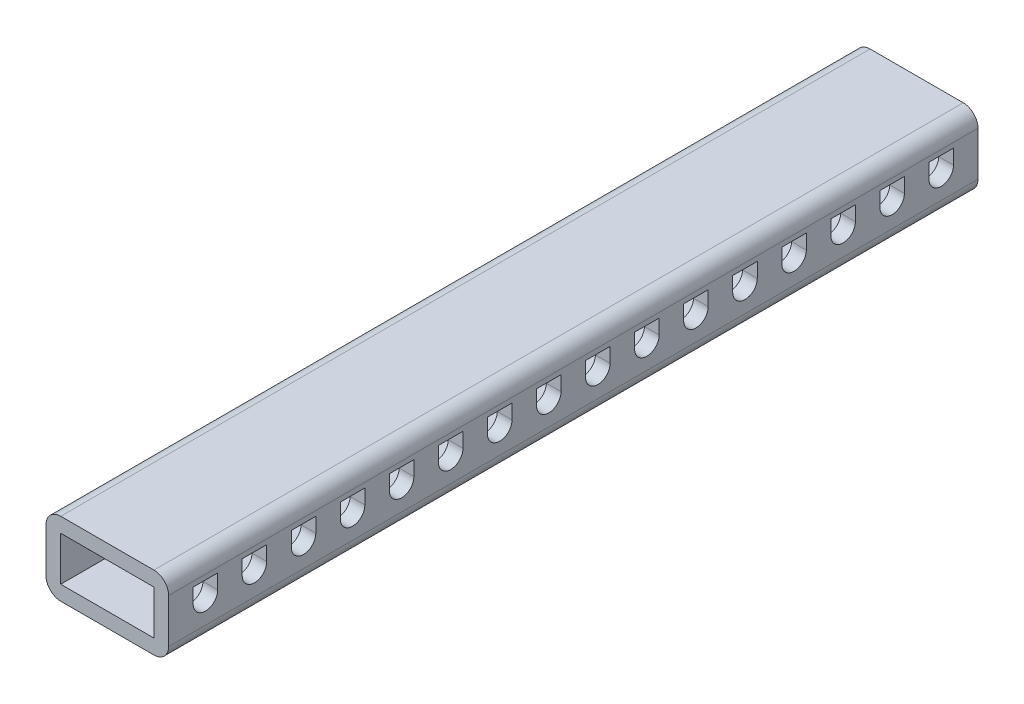
from build123d import *

# Parameters (mm, degrees)
SKETCH1_W           = 25
SKETCH1_H           = 15
BOSS_EXTRUDE1_DEPTH = 190
SKETCH2_W           = 19
SKETCH2_H           = 9
CUT_EXTRUDE1_DEPTH  = 263
CUT_EXTRUDE2_DEPTH  = 263
FILLET1_R           = 3
SKETCH4_W           = 44.57563551
SKETCH4_H           = 25
CUT_EXTRUDE3_DEPTH  = 35


with BuildPart() as part:
    # Sketch1 → Boss-Extrude1 (new body)
    with BuildSketch(Plane.XY):
        Rectangle(SKETCH1_W, SKETCH1_H)
    extrude(amount=BOSS_EXTRUDE1_DEPTH)

    # Sketch2 → Cut-Extrude1 (cut)
    with BuildSketch(Plane.XY.offset(190)):
        Rectangle(SKETCH2_W, SKETCH2_H)
    extrude(amount=-CUT_EXTRUDE1_DEPTH, mode=Mode.SUBTRACT)

    # Sketch3 → Cut-Extrude2 (cut)
    with BuildSketch(Plane(origin=(12.5, 0, 0), x_dir=(0, 0, -1), z_dir=(1, 0, 0))):
        with BuildLine():
            Line((-185, 3.5), (-185, 0.5))
            ThreePointArc((-185, 0.5), (-182.5, -2), (-180, 0.5))
            Line((-180, 0.5), (-180, 3.5))
            Line((-180, 3.5), (-185, 3.5))
        make_face()
        with BuildLine():
            ThreePointArc((-170, 0.5), (-172.5, -2), (-175, 0.5))
            Line((-175, 0.5), (-175, 3.5))
            Line((-175, 3.5), (-170, 3.5))
            Line((-170, 3.5), (-170, 0.5))
        make_face()
        with BuildLine():
            Line((-165, 3.5), (-165, 0.5))
            ThreePointArc((-165, 0.5), (-162.5, -2), (-160, 0.5))
            Line((-160, 0.5), (-160, 3.5))
            Line((-160, 3.5), (-165, 3.5))
        make_face()
        with BuildLine():
            ThreePointArc((-150, 0.5), (-152.5, -2), (-155, 0.5))
            Line((-155, 0.5), (-155, 3.5))
            Line((-155, 3.5), (-150, 3.5))
            Line((-150, 3.5), (-150, 0.5))
        make_face()
        with BuildLine():
            Line((-145, 3.5), (-145, 0.5))
            ThreePointArc((-145, 0.5), (-142.5, -2), (-140, 0.5))
            Line((-140, 0.5), (-140, 3.5))
            Line((-140, 3.5), (-145, 3.5))
        make_face()
        with BuildLine():
            ThreePointArc((-130, 0.5), (-132.5, -2), (-135, 0.5))
            Line((-135, 0.5), (-135, 3.5))
            Line((-135, 3.5), (-130, 3.5))
            Line((-130, 3.5), (-130, 0.5))
        make_face()
        with BuildLine():
            Line((-125, 3.5), (-125, 0.5))
            ThreePointArc((-125, 0.5), (-122.5, -2), (-120, 0.5))
            Line((-120, 0.5), (-120, 3.5))
            Line((-120, 3.5), (-125, 3.5))
        make_face()
        with BuildLine():
            ThreePointArc((-110, 0.5), (-112.5, -2), (-115, 0.5))
            Line((-115, 0.5), (-115, 3.5))
            Line((-115, 3.5), (-110, 3.5))
            Line((-110, 3.5), (-110, 0.5))
        make_face()
        with BuildLine():
            Line((-105, 3.5), (-105, 0.5))
            ThreePointArc((-105, 0.5), (-102.5, -2), (-100, 0.5))
            Line((-100, 0.5), (-100, 3.5))
            Line((-100, 3.5), (-105, 3.5))
        make_face()
        with BuildLine():
            ThreePointArc((-90, 0.5), (-92.5, -2), (-95, 0.5))
            Line((-95, 0.5), (-95, 3.5))
            Line((-95, 3.5), (-90, 3.5))
            Line((-90, 3.5), (-90, 0.5))
        make_face()
        with BuildLine():
            Line((-85, 3.5), (-85, 0.5))
            ThreePointArc((-85, 0.5), (-82.5, -2), (-80, 0.5))
            Line((-80, 0.5), (-80, 3.5))
            Line((-80, 3.5), (-85, 3.5))
        make_face()
        with BuildLine():
            ThreePointArc((-70, 0.5), (-72.5, -2), (-75, 0.5))
            Line((-75, 0.5), (-75, 3.5))
            Line((-75, 3.5), (-70, 3.5))
            Line((-70, 3.5), (-70, 0.5))
        make_face()
        with BuildLine():
            Line((-65, 3.5), (-65, 0.5))
            ThreePointArc((-65, 0.5), (-62.5, -2), (-60, 0.5))
            Line((-60, 0.5), (-60, 3.5))
            Line((-60, 3.5), (-65, 3.5))
        make_face()
        with BuildLine():
            ThreePointArc((-50, 0.5), (-52.5, -2), (-55, 0.5))
            Line((-55, 0.5), (-55, 3.5))
            Line((-55, 3.5), (-50, 3.5))
            Line((-50, 3.5), (-50, 0.5))
        make_face()
        with BuildLine():
            Line((-45, 3.5), (-45, 0.5))
            ThreePointArc((-45, 0.5), (-42.5, -2), (-40, 0.5))
            Line((-40, 0.5), (-40, 3.5))
            Line((-40, 3.5), (-45, 3.5))
        make_face()
        with BuildLine():
            ThreePointArc((-30, 0.5), (-32.5, -2), (-35, 0.5))
            Line((-35, 0.5), (-35, 3.5))
            Line((-35, 3.5), (-30, 3.5))
            Line((-30, 3.5), (-30, 0.5))
        make_face()
        with BuildLine():
            Line((-25, 3.5), (-25, 0.5))
            ThreePointArc((-25, 0.5), (-22.5, -2), (-20, 0.5))
            Line((-20, 0.5), (-20, 3.5))
            Line((-20, 3.5), (-25, 3.5))
        make_face()
        with BuildLine():
            ThreePointArc((-10, 0.5), (-12.5, -2), (-15, 0.5))
            Line((-15, 0.5), (-15, 3.5))
            Line((-15, 3.5), (-10, 3.5))
            Line((-10, 3.5), (-10, 0.5))
        make_face()
        with BuildLine():
            Line((-5, 3.5), (-5, 0.5))
            ThreePointArc((-5, 0.5), (-2.5, -2), (0, 0.5))
            Line((0, 0.5), (0, 3.5))
            Line((0, 3.5), (-5, 3.5))
        make_face()
        with BuildLine():
            ThreePointArc((10, 0.5), (7.5, -2), (5, 0.5))
            Line((5, 0.5), (5, 3.5))
            Line((5, 3.5), (10, 3.5))
            Line((10, 3.5), (10, 0.5))
        make_face()
        with BuildLine():
            Line((15, 3.5), (15, 0.5))
            ThreePointArc((15, 0.5), (17.5, -2), (20, 0.5))
            Line((20, 0.5), (20, 3.5))
            Line((20, 3.5), (15, 3.5))
        make_face()
        with BuildLine():
            ThreePointArc((30, 0.5), (27.5, -2), (25, 0.5))
            Line((25, 0.5), (25, 3.5))
            Line((25, 3.5), (30, 3.5))
            Line((30, 3.5), (30, 0.5))
        make_face()
    extrude(amount=-CUT_EXTRUDE2_DEPTH, mode=Mode.SUBTRACT)

    # Fillet1
    fillet1_edges = [part.edges().sort_by_distance(p)[0] for p in [
        (12.5, -7.5, 95),
        (-12.5, -7.5, 95),
        (-12.5, 7.5, 95),
        (12.5, 7.5, 95),
    ]]
    fillet(fillet1_edges, radius=FILLET1_R)

    # Sketch4 → Cut-Extrude3 (cut)
    with BuildSketch(Plane(origin=(0, 7.5, 0), x_dir=(1, 0, 0), z_dir=(0, 1, 0))):
        with Locations((9.787817755, -12.5)):
            Rectangle(SKETCH4_W, SKETCH4_H)
    extrude(amount=-CUT_EXTRUDE3_DEPTH, mode=Mode.SUBTRACT)


solid = part.part
